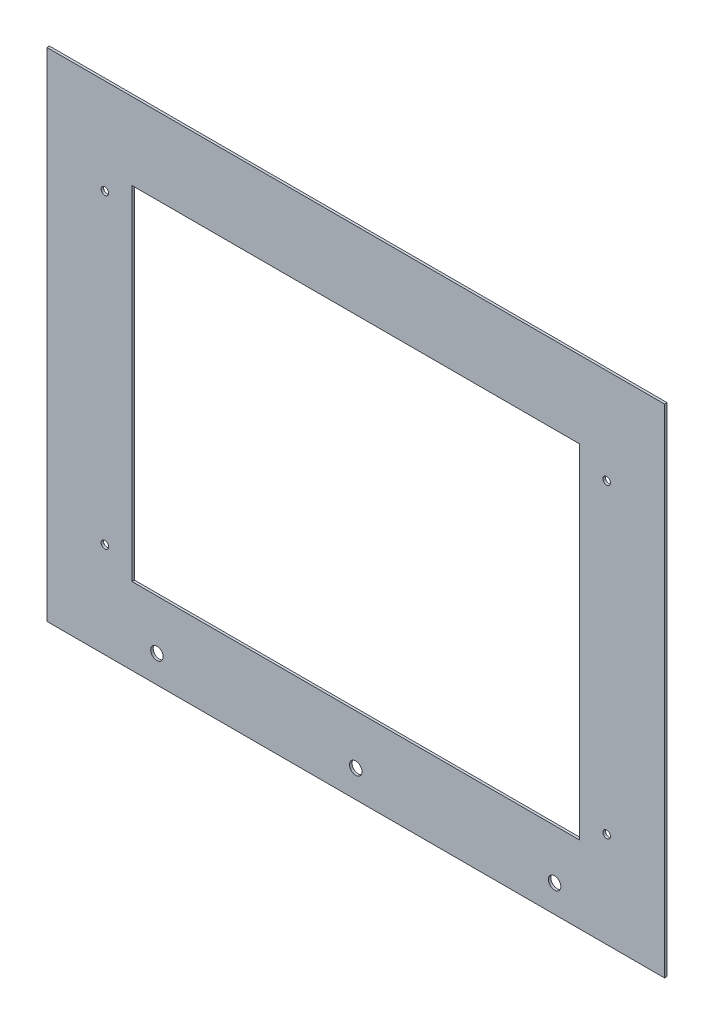
from build123d import *

# Parameters (mm, degrees)
SKETCH_1_W      = 248.5
SKETCH_1_H      = 200
SKETCH_1_R      = 2.5
SKETCH_1_R_2    = 1.5
SKETCH_1_W_2    = 180
SKETCH_1_H_2    = 138
EXTRUDE_1_DEPTH = 0.5


with BuildPart() as part:
    # 스케치1 → 보스-돌출1 (new, symmetric)
    with BuildSketch(Plane.XY):
        with Locations((124.25, 100)):
            Rectangle(SKETCH_1_W, SKETCH_1_H)
        with Locations((124.25, 11)):
            Circle(SKETCH_1_R, mode=Mode.SUBTRACT)
        with Locations((204.25, 11)):
            Circle(SKETCH_1_R, mode=Mode.SUBTRACT)
        with Locations((44.25, 11)):
            Circle(SKETCH_1_R, mode=Mode.SUBTRACT)
        with Locations((225.215, 161.595)):
            Circle(SKETCH_1_R_2, mode=Mode.SUBTRACT)
        with Locations((225.215, 38.405)):
            Circle(SKETCH_1_R_2, mode=Mode.SUBTRACT)
        with Locations(Location((23.285, 38.405, 0), (0, 0, 180))):
            Circle(SKETCH_1_R_2, mode=Mode.SUBTRACT)
        with Locations(Location((23.285, 161.595, 0), (0, 0, 180))):
            Circle(SKETCH_1_R_2, mode=Mode.SUBTRACT)
        with Locations((124.25, 100)):
            Rectangle(SKETCH_1_W_2, SKETCH_1_H_2, mode=Mode.SUBTRACT)
    extrude(amount=EXTRUDE_1_DEPTH, both=True)


solid = part.part
